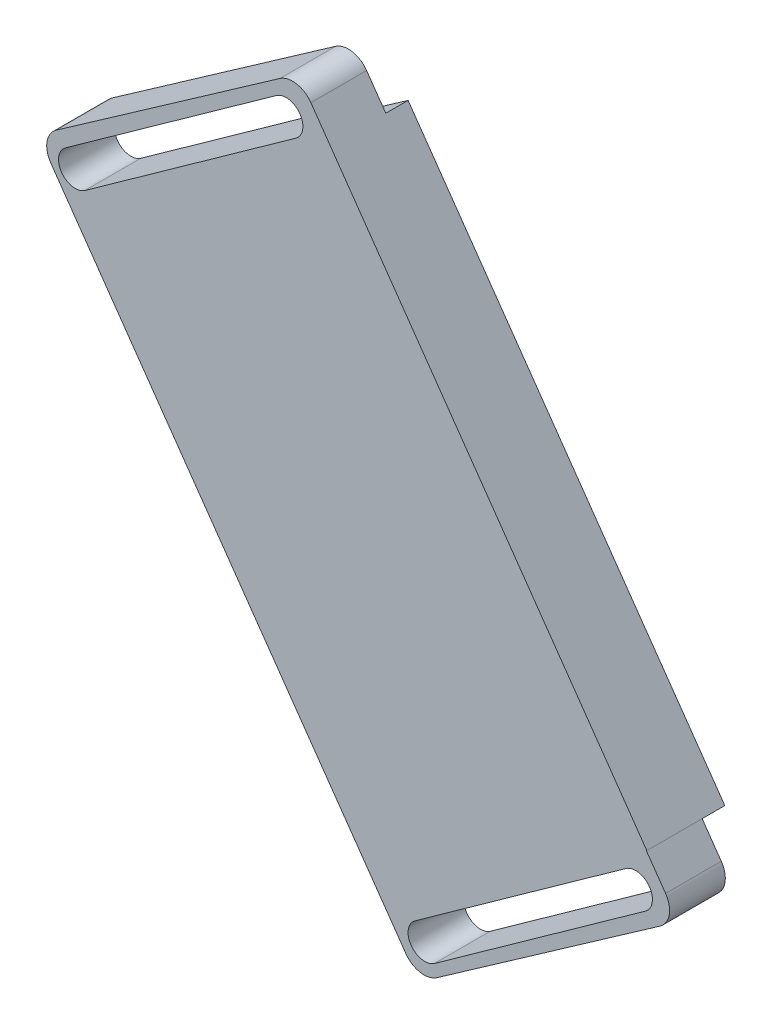
from build123d import *

# Parameters (mm, degrees)
ESTRUSIONE_ESTRUSIONE1_DEPTH  = 7
TAGLIO_ESTRUSIONE1_DEPTH      = 6
SCHIZZO3_W                    = 16
SCHIZZO3_H                    = 7
ESTRUSIONE_ESTRUSIONE2_DEPTH  = 49.55
SCHIZZO6_W                    = 28.452677992
SCHIZZO6_H                    = 5
ESTRUSIONE_ESTRUSIONE5_DEPTH  = 5
SCHIZZO7_W                    = 28.5
SCHIZZO7_H                    = 5
ESTRUSIONE_ESTRUSIONE6_DEPTH  = 5
TAGLIO_ESTRUSIONE8_DEPTH      = 52.802078251
TAGLIO_ESTRUSIONE8_DEPTH_BACK = 52.802078251
RACCORDO1_R                   = 2


with BuildPart() as part:
    # Schizzo1 → Estrusione-Estrusione1 (new body)
    with BuildSketch(Plane.XY):
        Polygon((-15.909106105, 13.642580206), (-5.669705551, 20.812285661), (22.75100687, -19.776698134), (12.511606316, -26.946403588), align=None)
    extrude(amount=ESTRUSIONE_ESTRUSIONE1_DEPTH)

    # Schizzo1<3> → Taglio-Estrusione1 (cut)
    with BuildSketch(Plane.XY):
        Polygon((-14.500401843, 14.443682773), (13.695602758, -25.824384995), (13.204111531, -26.168530857), (-14.991893069, 14.099536911), align=None)
        Polygon((-6.36666227, 20.087622092), (-6.858153497, 19.74347623), (21.304903969, -20.477538154), (21.796395196, -20.133392292), align=None)
    extrude(amount=TAGLIO_ESTRUSIONE1_DEPTH, mode=Mode.SUBTRACT)

    # Schizzo3 → Estrusione-Estrusione2 (add)
    with BuildSketch(Plane(origin=(16.77686077, -23.959840268, 0), x_dir=(-0.8191520442889922, -0.5735764363510456, 0), z_dir=(0.5735764363510455, -0.8191520442889921, 0))):
        with Locations((-15.293085749, -3.5)):
            Rectangle(SCHIZZO3_W, SCHIZZO3_H)
    extrude(amount=-ESTRUSIONE_ESTRUSIONE2_DEPTH)

    # Schizzo6 → Estrusione-Estrusione5 (add)
    with BuildSketch(Plane(origin=(16.77686077, -23.959840268, 0), x_dir=(-0.8191520442889922, -0.5735764363510456, 0), z_dir=(0.5735764363510455, -0.8191520442889921, 0))):
        with Locations((-9.019424745, -4.5)):
            Rectangle(SCHIZZO6_W, SCHIZZO6_H)
    extrude(amount=ESTRUSIONE_ESTRUSIONE5_DEPTH)

    # Schizzo7 → Estrusione-Estrusione6 (add)
    with BuildSketch(Plane(origin=(-11.643851652, 16.629143527, 0), x_dir=(0.8191520442889902, 0.5735764363510484, 0), z_dir=(-0.5735764363510484, 0.8191520442889902, 0))):
        with Locations((9.043085749, -4.5)):
            Rectangle(SCHIZZO7_W, SCHIZZO7_H)
    extrude(amount=ESTRUSIONE_ESTRUSIONE6_DEPTH)

    # Schizzo8 → Taglio-Estrusione8 (cut, two sides: drawn at the far end of the back side and taken through both)
    with BuildSketch(Plane(origin=(0, 0, 2), x_dir=(-1, 0, 0), z_dir=(0, 0, -1)).offset(-TAGLIO_ESTRUSIONE8_DEPTH_BACK)):
        with BuildLine():
            Line((-33.988775508, -12.923786256), (-15.062626046, -26.452245662))
            ThreePointArc((-15.062626046, -26.452245662), (-14.714599039, -28.544822352), (-16.807175729, -28.892849359))
            Line((-16.807175729, -28.892849359), (-35.733325191, -15.364389953))
            ThreePointArc((-35.733325191, -15.364389953), (-36.081352198, -13.271813263), (-33.988775508, -12.923786256))
        make_face()
        with BuildLine():
            Line((-2.62416195, 31.45957899), (16.301987512, 17.931119584))
            ThreePointArc((16.301987512, 17.931119584), (16.650014519, 15.838542895), (14.55743783, 15.490515888))
            Line((14.55743783, 15.490515888), (-4.368711632, 29.018975294))
            ThreePointArc((-4.368711632, 29.018975294), (-4.71673864, 31.111551983), (-2.62416195, 31.45957899))
        make_face()
    extrude(amount=TAGLIO_ESTRUSIONE8_DEPTH + TAGLIO_ESTRUSIONE8_DEPTH_BACK, mode=Mode.SUBTRACT)

    # Raccordo1
    raccordo1_edges = [part.edges().sort_by_distance(p)[0] for p in [
        (15.379488498, -31.04216381, 4.5),
        (38.686557841, -14.722378162, 4.5),
        (-18.776988287, 17.738340428, 4.5),
        (4.568844976, 34.085268864, 4.5),
    ]]
    fillet(raccordo1_edges, radius=RACCORDO1_R)


solid = part.part
